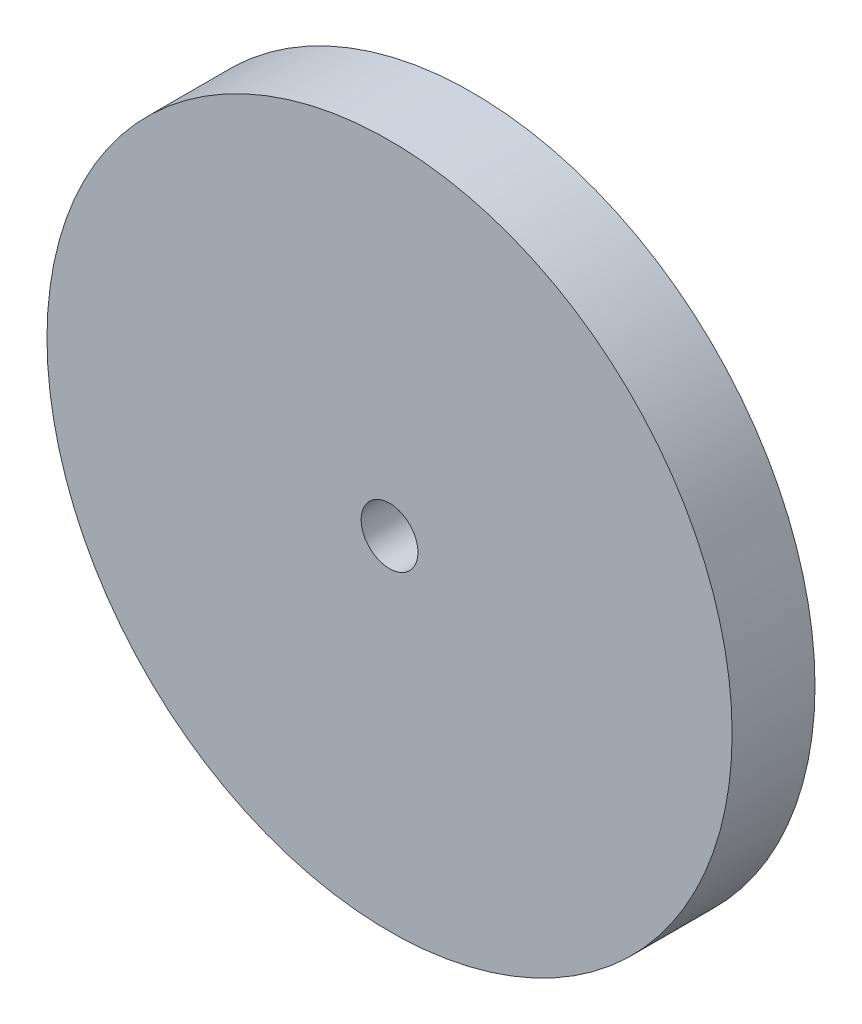
from build123d import *

# Parameters (mm, degrees)
SKETCH1_R           = 24.145
SKETCH1_R_2         = 2
BOSS_EXTRUDE1_DEPTH = 5.842


with BuildPart() as part:
    # Sketch1 → Boss-Extrude1 (new body)
    with BuildSketch(Plane.XY.offset(4.7625)):
        with Locations((-41.488120366, 0)):
            Circle(SKETCH1_R)
        with Locations((-41.488120366, 0)):
            Circle(SKETCH1_R_2, mode=Mode.SUBTRACT)
    extrude(amount=BOSS_EXTRUDE1_DEPTH)


solid = part.part
